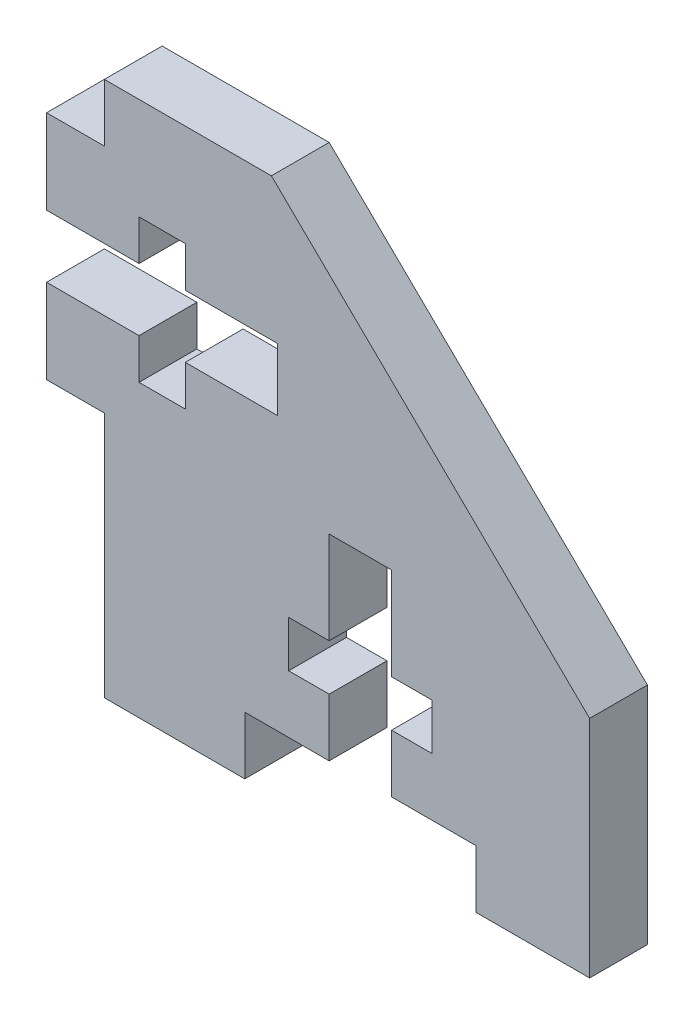
from build123d import *

# Parameters (mm, degrees)
BOSS_EXTRUDE1_DEPTH = 3.175


with BuildPart() as part:
    # Sketch1 → Boss-Extrude1 (new body)
    with BuildSketch(Plane.XY):
        Polygon((0, 0), (0, 4.6355), (5.08, 4.6355), (5.08, 2.413), (7.62, 2.413), (7.62, 4.6355), (12.7, 4.6355), (12.7, 8.0645), (7.62, 8.0645), (7.62, 10.287), (5.08, 10.287), (5.08, 8.0645), (0, 8.0645), (0, 12.7), (3.175, 12.7), (3.175, 15.875), (12.351019445, 15.875), (29.833931672, -1.196941607), (29.833931672, -10.372961052), (29.833931672, -13.547961052), (23.589249692, -13.547961052), (23.589249692, -10.372961052), (18.953749692, -10.372961052), (18.953749692, -7.197961052), (21.176249692, -7.197961052), (21.176249692, -4.657961052), (18.953749692, -4.657961052), (18.953749692, 0.422038948), (15.524749692, 0.422038948), (15.524749692, -4.657961052), (13.302249692, -4.657961052), (13.302249692, -7.197961052), (15.524749692, -7.197961052), (15.524749692, -10.372961052), (10.889249692, -10.372961052), (10.889249692, -13.547961052), (3.175, -13.547961052), (3.175, -10.372961052), (3.175, 0), align=None)
    extrude(amount=BOSS_EXTRUDE1_DEPTH)


solid = part.part
